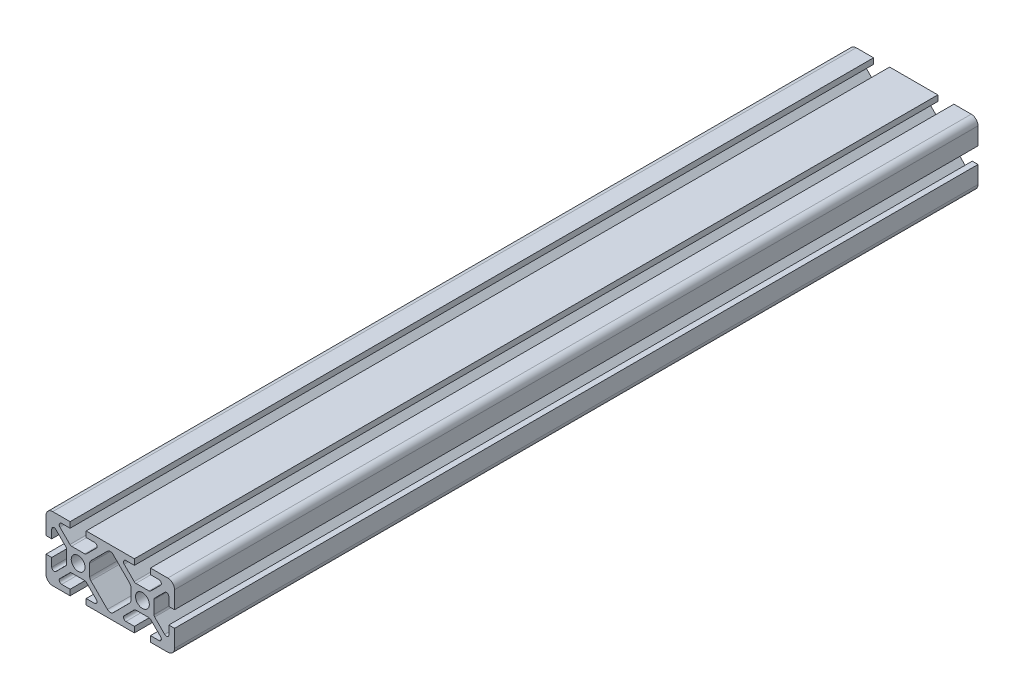
from build123d import *

# Parameters (mm, degrees)
BOSS_EXTRUDE1_DEPTH = 125.000000063
BOSS_EXTRUDE2_DEPTH = 125.000000063
FILLET1_R           = 0.75
FILLET2_R           = 1.25


with BuildPart() as part:
    # Sketch3 → Boss-Extrude1 (new, symmetric)
    with BuildSketch(Plane.XY):
        with BuildLine():
            Line((12.5, -10), (17.9, -10))
            ThreePointArc((17.9, -10), (19.38492424, -9.38492424), (20, -7.9))
            Line((20, -7.9), (20, -2.5))
            Line((20, -2.5), (18.213351365, -2.5))
            Line((18.213351365, -2.5), (18.213351365, -6.95))
            Line((18.213351365, -6.95), (13.6, -2.336648635))
            Line((13.6, -2.336648635), (13.6, 0))
            Line((13.6, 0), (12.15, 0))
            ThreePointArc((12.15, 0), (11.52027958, -1.52027958), (10, -2.15))
            Line((10, -2.15), (10, -3.6))
            Line((10, -3.6), (12.336648635, -3.6))
            Line((12.336648635, -3.6), (16.95, -8.213351365))
            Line((16.95, -8.213351365), (12.5, -8.213351365))
            Line((12.5, -8.213351365), (12.5, -10))
        make_face()
    extrude(amount=BOSS_EXTRUDE1_DEPTH, both=True)

    # Sketch4 → Boss-Extrude2 (add, symmetric)
    with BuildSketch(Plane.XY):
        with BuildLine():
            Line((10, -3.6), (7.663351365, -3.6))
            Line((7.663351365, -3.6), (3.05, -8.213351365))
            Line((3.05, -8.213351365), (7.5, -8.213351365))
            Line((7.5, -8.213351365), (7.5, -10))
            Line((7.5, -10), (0, -10))
            Line((0, -10), (0, -8.736648635))
            Line((0, -8.736648635), (6.4, -2.336648635))
            Line((6.4, -2.336648635), (6.4, 0))
            Line((6.4, 0), (7.85, 0))
            ThreePointArc((7.85, 0), (8.47972042, -1.52027958), (10, -2.15))
            Line((10, -2.15), (10, -3.6))
        make_face()
    extrude(amount=BOSS_EXTRUDE2_DEPTH, both=True)

    # Mirror1: part across plane


with BuildPart() as part_1:
    add(part.part)
    add(part.part.mirror(Plane(origin=(0, 0, 0), x_dir=(0, 0, 1), z_dir=(1, 0, 0))))

    # Mirror2: part across plane


with BuildPart() as part_2:
    add(part_1.part)
    add(part_1.part.mirror(Plane.ZX))

    # Fillet1
    fillet1_edges = [part_2.edges().sort_by_distance(p)[0] for p in [
        (18.213351365, 6.95, 0),
        (13.6, 2.336648635, 0),
        (12.336648635, 3.6, 0),
        (16.95, 8.213351365, 0),
        (3.05, 8.213351365, 0),
        (7.663351365, 3.6, 0),
        (-18.213351365, 6.95, 0),
        (-13.6, 2.336648635, 0),
        (-7.663351365, 3.6, 0),
        (-12.336648635, 3.6, 0),
        (-16.95, 8.213351365, 0),
        (-3.05, 8.213351365, 0),
        (16.95, -8.213351365, 0),
        (12.336648635, -3.6, 0),
        (13.6, -2.336648635, 0),
        (18.213351365, -6.95, 0),
        (3.05, -8.213351365, 0),
        (7.663351365, -3.6, 0),
        (-18.213351365, -6.95, 0),
        (-13.6, -2.336648635, 0),
        (-12.336648635, -3.6, 0),
        (-16.95, -8.213351365, 0),
        (-3.05, -8.213351365, 0),
        (-7.663351365, -3.6, 0),
    ]]
    fillet(fillet1_edges, radius=FILLET1_R)

    # Fillet2
    fillet2_edges = [part_2.edges().sort_by_distance(p)[0] for p in [
        (6.4, 2.336648635, 0),
        (0, 8.736648635, 0),
        (-6.4, 2.336648635, 0),
        (6.4, -2.336648635, 0),
        (-6.4, -2.336648635, 0),
        (0, -8.736648635, 0),
    ]]
    fillet(fillet2_edges, radius=FILLET2_R)


solid = part_2.part
